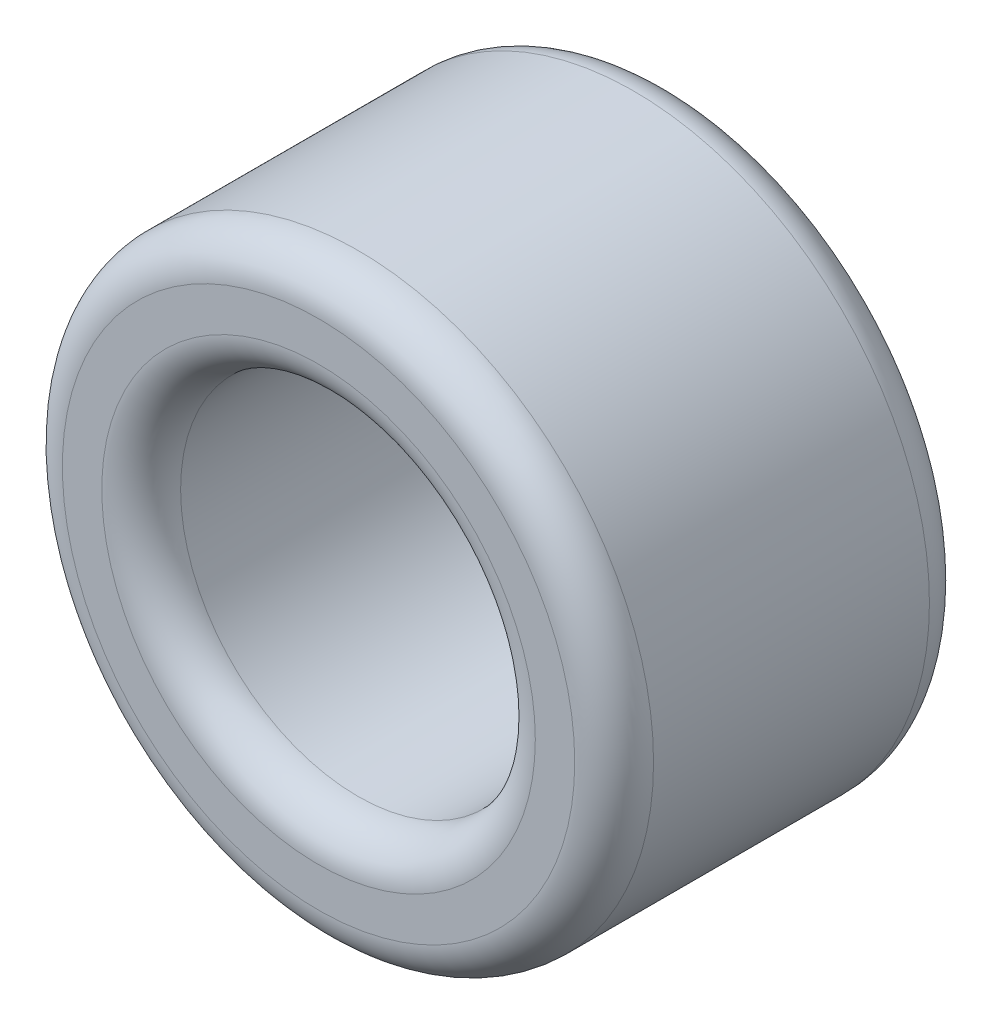
from build123d import *

# Parameters (mm, degrees)
SKETCH1_R           = 3.75
SKETCH1_R_2         = 2.25
BOSS_EXTRUDE2_DEPTH = 2.25
FILLET1_R           = 0.5


with BuildPart() as part:
    # Sketch1 → Boss-Extrude2 (new, symmetric)
    with BuildSketch(Plane.XY.offset(58)):
        with Locations((-4.039970845, 19.325746234)):
            Circle(SKETCH1_R)
        with Locations((-4.039970845, 19.325746234)):
            Circle(SKETCH1_R_2, mode=Mode.SUBTRACT)
    extrude(amount=BOSS_EXTRUDE2_DEPTH, both=True)

    # Fillet1
    fillet1_edges = [part.edges().sort_by_distance(p)[0] for p in [
        (-7.789970845, 19.325746234, 55.75),
        (-7.789970845, 19.325746234, 60.25),
        (-6.289970845, 19.325746234, 55.75),
        (-6.289970845, 19.325746234, 60.25),
    ]]
    fillet(fillet1_edges, radius=FILLET1_R)


solid = part.part
